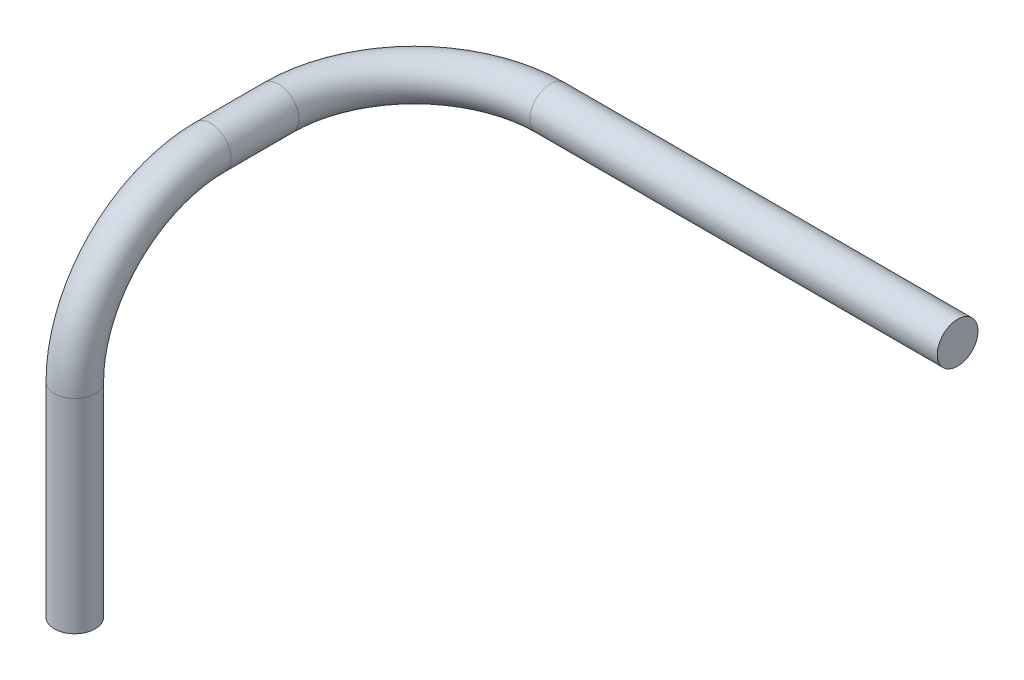
from build123d import *

# Parameters (mm, degrees)
BALAYAGE1_PROFILE_R = 1.5


with BuildPart() as part:
    # Balayage1: sweep along a curve in space
    with BuildLine() as balayage1_path:
        Line((0, 0, 0), (0, 15, 0))
        ThreePointArc((0, 15, 0), (0, 22.071067812, -2.928932188), (0, 25, -10))
        Line((0, 25, -10), (0, 25, -15))
        ThreePointArc((0, 25, -15), (2.928932188, 25, -22.071067812), (10, 25, -25))
        Line((10, 25, -25), (40, 25, -25))
    # Balayage1 profile (on start of the path) → Balayage1 (sweep)
    with BuildSketch(Plane.ZX):
        Circle(BALAYAGE1_PROFILE_R)
    sweep(path=balayage1_path.line)


solid = part.part
